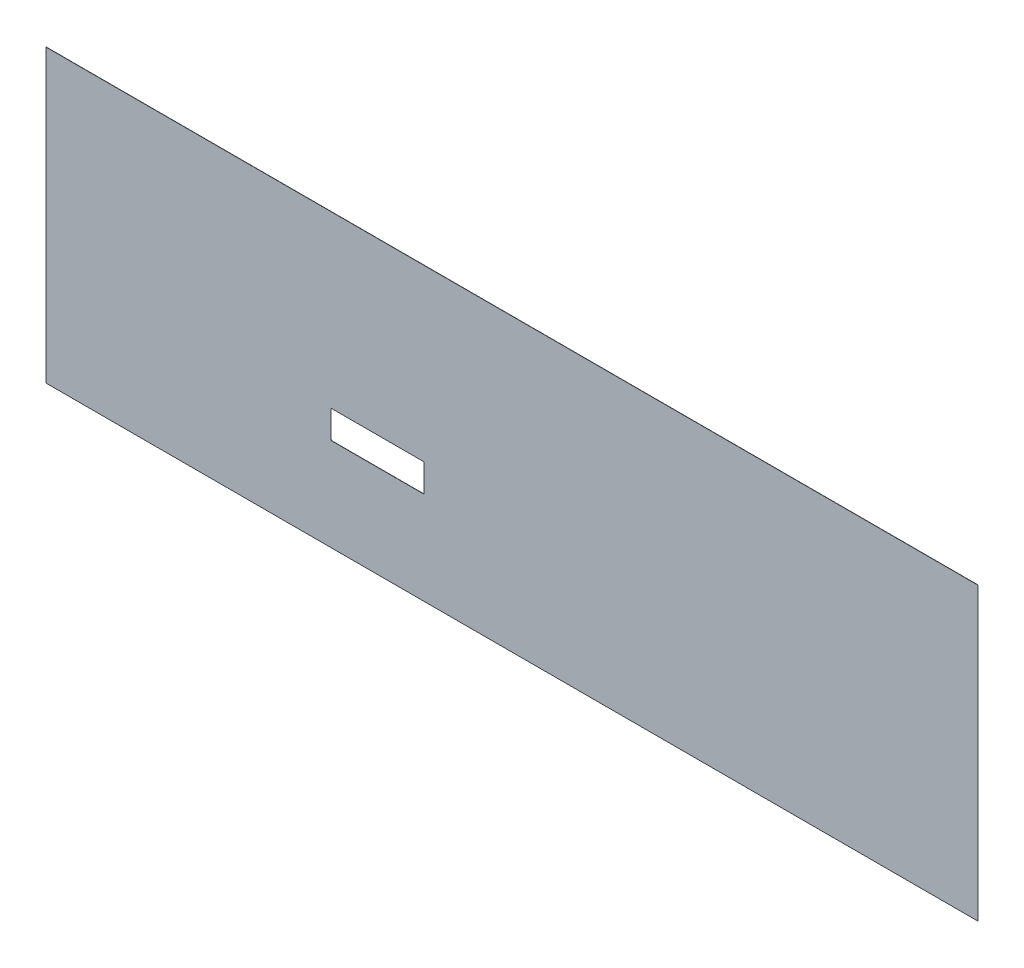
from build123d import *

# Parameters (mm, degrees)
SKETCH2_W           = 6343.65
SKETCH2_H           = 1981.2
BOSS_EXTRUDE1_DEPTH = 1.5875


with BuildPart() as part:
    # Sketch2 → Boss-Extrude1 (new body)
    with BuildSketch(Plane.XY.offset(-8280.4)):
        with Locations((2308.225, 996.98175)):
            Rectangle(SKETCH2_W, SKETCH2_H)
        with BuildLine():
            Line((1711.325, 644.55675), (1711.325, 822.35675))
            ThreePointArc((1711.325, 822.35675), (1709.465128061, 826.846878061), (1704.975, 828.70675))
            Line((1704.975, 828.70675), (1082.675, 828.70675))
            ThreePointArc((1082.675, 828.70675), (1078.184871939, 826.846878061), (1076.325, 822.35675))
            Line((1076.325, 822.35675), (1076.325, 644.55675))
            ThreePointArc((1076.325, 644.55675), (1078.184871939, 640.066621939), (1082.675, 638.20675))
            Line((1082.675, 638.20675), (1704.975, 638.20675))
            ThreePointArc((1704.975, 638.20675), (1709.465128061, 640.066621939), (1711.325, 644.55675))
        make_face(mode=Mode.SUBTRACT)
    extrude(amount=-BOSS_EXTRUDE1_DEPTH)


solid = part.part
